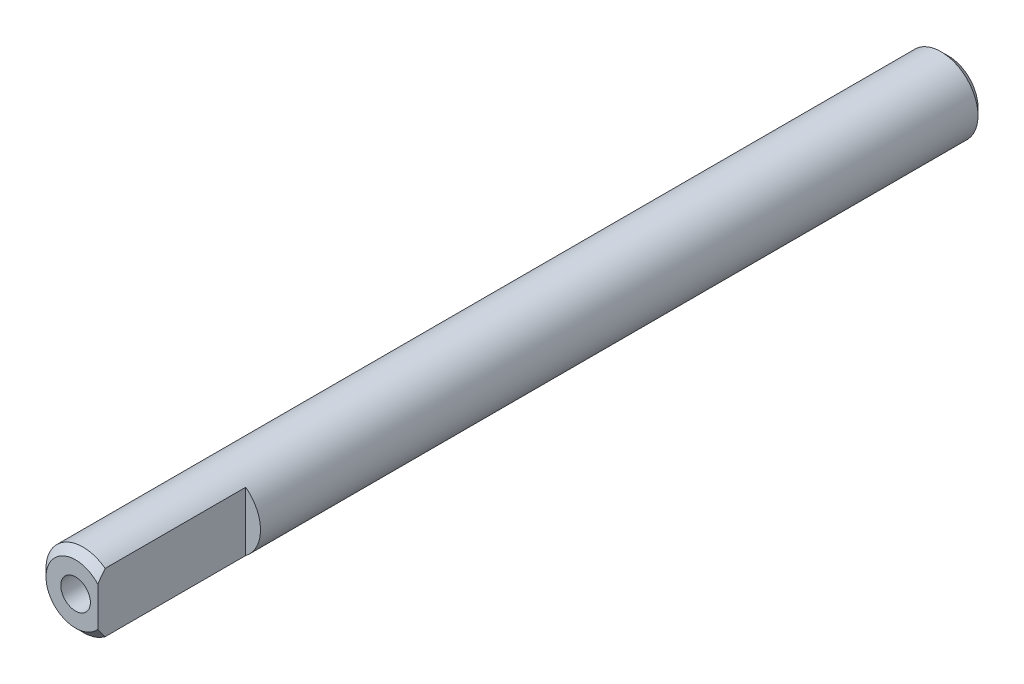
from build123d import *

# Parameters (mm, degrees)
SKETCH1_R           = 2.5
BOSS_EXTRUDE1_DEPTH = 59
SKETCH2_R           = 1
CUT_EXTRUDE1_DEPTH  = 10
CHAMFER1_SIZE       = 0.5
SKETCH3_W           = 1.530069222
SKETCH3_H           = 4.686409644
CUT_EXTRUDE2_DEPTH  = 10


with BuildPart() as part:
    # Sketch1 → Boss-Extrude1 (new body)
    with BuildSketch(Plane.XY):
        Circle(SKETCH1_R)
    extrude(amount=BOSS_EXTRUDE1_DEPTH)

    # Sketch2 → Cut-Extrude1 (cut)
    with BuildSketch(Plane.XY.offset(59)):
        Circle(SKETCH2_R)
    extrude(amount=-CUT_EXTRUDE1_DEPTH, mode=Mode.SUBTRACT)

    # Chamfer1
    chamfer1_edges = [part.edges().sort_by_distance(p)[0] for p in [
        (-2.5, 0, 0),
        (-2.5, 0, 59),
    ]]
    chamfer(chamfer1_edges, length=CHAMFER1_SIZE)

    # Sketch3 → Cut-Extrude2 (cut)
    with BuildSketch(Plane.XY.offset(59)):
        with Locations((2.265034611, -0.329447038)):
            Rectangle(SKETCH3_W, SKETCH3_H)
    extrude(amount=-CUT_EXTRUDE2_DEPTH, mode=Mode.SUBTRACT)


solid = part.part
